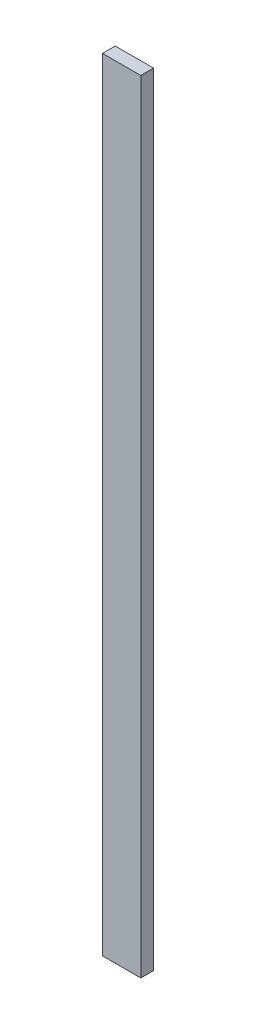
from build123d import *

# Parameters (mm, degrees)
SKETCH1_W     = 12
SKETCH1_H     = 245
PROFILE_DEPTH = 4


with BuildPart() as part:
    # Sketch1 → Profile (new body)
    with BuildSketch(Plane.XY):
        with Locations((6, 122.5)):
            Rectangle(SKETCH1_W, SKETCH1_H)
    extrude(amount=PROFILE_DEPTH)


solid = part.part
